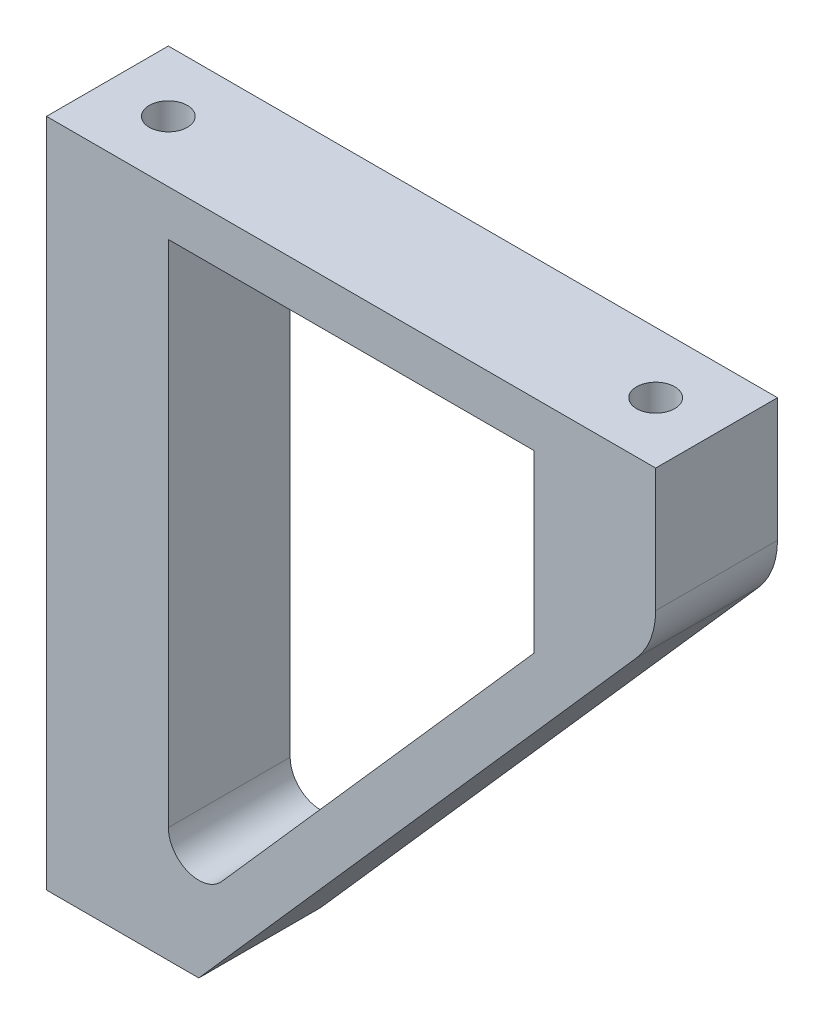
from build123d import *

# Parameters (mm, degrees)
EXTRUDE_958_DEPTH      = 8
SKETCH_5_R             = 1.25
CUT_EXTRUDE_1488_DEPTH = 13
SKETCH_6_R             = 1.25
CUT_EXTRUDE_1665_DEPTH = 10
FILLET_2_R             = 5


with BuildPart() as part:
    # Эскиз1 → Extrude 958 (new body)
    with BuildSketch(Plane.XY):
        Polygon((-20, 22), (-20, -22), (-10, -22), (20, 12), (20, 22), align=None)
        with BuildLine():
            Line((-12, 19), (-12, -14.442810634))
            ThreePointArc((-12, -14.442810634), (-10.707336051, -16.313552656), (-8.500324289, -15.766053908))
            Line((-8.500324289, -15.766053908), (12, 7.467646953))
            Line((12, 7.467646953), (12, 19))
            Line((12, 19), (-12, 19))
        make_face(mode=Mode.SUBTRACT)
    extrude(amount=EXTRUDE_958_DEPTH)

    # Эскиз5 → Cut-Extrude 1488 (cut)
    with BuildSketch(Plane.XZ.offset(22)):
        with Locations((-16, 4)):
            Circle(SKETCH_5_R)
    cut_extrude_1488 = extrude(amount=-CUT_EXTRUDE_1488_DEPTH, mode=Mode.SUBTRACT)

    # Эскиз6 → Cut-Extrude 1665 (cut)
    with BuildSketch(Plane(origin=(0, 22, 0), x_dir=(1, 0, 0), z_dir=(0, 1, 0))):
        with Locations(Location((16, -4, 0), (0, 0, 270))):
            Circle(SKETCH_6_R)
    extrude(amount=-CUT_EXTRUDE_1665_DEPTH, mode=Mode.SUBTRACT)

    # Скругление2
    fillet_2_edges = [part.edges().sort_by_distance(p)[0] for p in [
        (20, 12, 4),
    ]]
    fillet(fillet_2_edges, radius=FILLET_2_R)

    # Зеркальное отражение1: Cut-Extrude 1488 across plane
    add(cut_extrude_1488.mirror(Plane.ZX), mode=Mode.SUBTRACT)


solid = part.part
